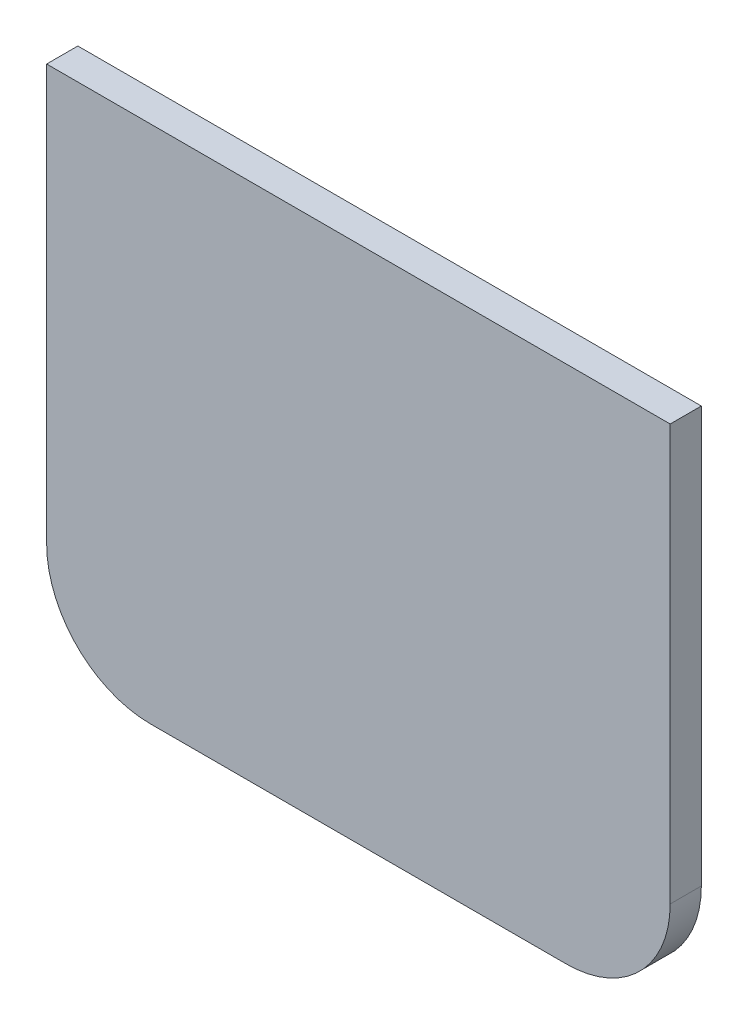
from build123d import *

# Parameters (mm, degrees)
BOSS_EXTRU_1_DEPTH = 15


with BuildPart() as part:
    # Esquisse1 → Boss.-Extru.1 (new body)
    with BuildSketch(Plane.XY):
        with BuildLine():
            Line((-100, -125), (100, -125))
            ThreePointArc((100, -125), (135.355339059, -110.355339059), (150, -75))
            Line((150, -75), (150, 125))
            Line((150, 125), (-150, 125))
            Line((-150, 125), (-150, -75))
            ThreePointArc((-150, -75), (-135.355339059, -110.355339059), (-100, -125))
        make_face()
    extrude(amount=BOSS_EXTRU_1_DEPTH)


solid = part.part
